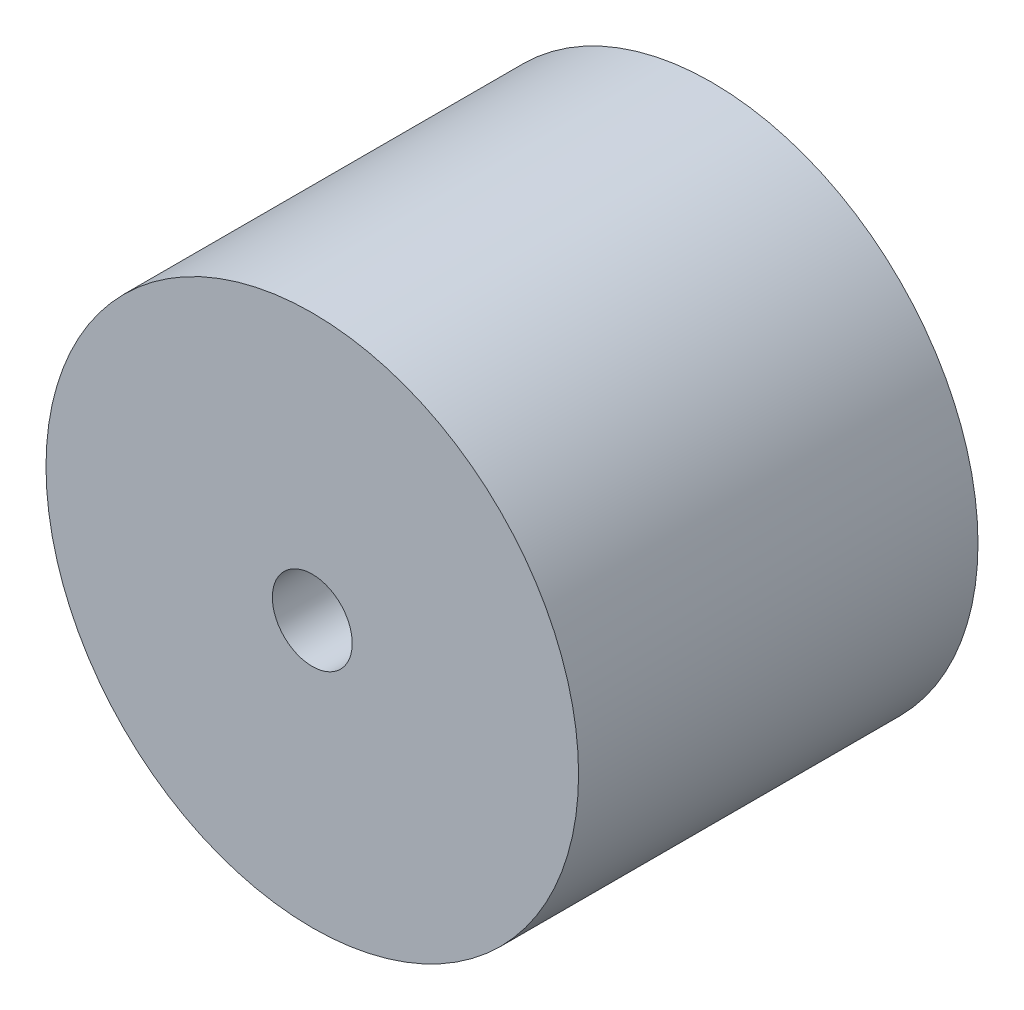
from build123d import *

# Parameters (mm, degrees)
SKETCH_1_R          = 20
SKETCH_1_R_2        = 7
EXTRUDE_1_DEPTH     = 20
SKETCH_2_R          = 20
EXTRUDE_2_DEPTH     = 10
SKETCH_3_R          = 3
CUT_EXTRUDE_1_DEPTH = 10
SKETCH_4_R          = 3.5
CUT_EXTRUDE_2_DEPTH = 25


with BuildPart() as part:
    # 草图1 → 凸台-拉伸1 (new body)
    with BuildSketch(Plane.XY):
        Circle(SKETCH_1_R)
        Circle(SKETCH_1_R_2, mode=Mode.SUBTRACT)
    extrude(amount=EXTRUDE_1_DEPTH)

    # 草图2 → 凸台-拉伸2 (add)
    with BuildSketch(Plane.XY.offset(20)):
        Circle(SKETCH_2_R)
    extrude(amount=EXTRUDE_2_DEPTH)

    # 草图3 → 切除-拉伸1 (cut)
    with BuildSketch(Plane.XY.offset(30)):
        Circle(SKETCH_3_R)
    extrude(amount=-CUT_EXTRUDE_1_DEPTH, mode=Mode.SUBTRACT)

    # 草图4 → 切除-拉伸2 (cut)
    with BuildSketch(Plane(origin=(0, 0, 0), x_dir=(-1, 0, 0), z_dir=(0, 0, -1))):
        with Locations((0, 12)):
            Circle(SKETCH_4_R)
    extrude(amount=-CUT_EXTRUDE_2_DEPTH, mode=Mode.SUBTRACT)


solid = part.part
